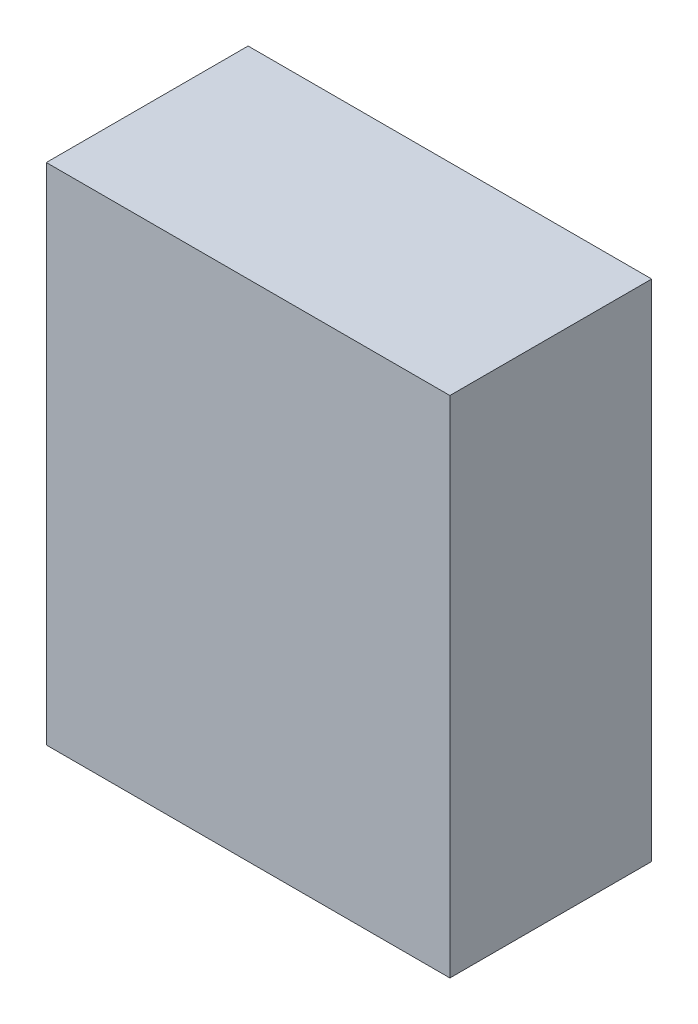
from build123d import *

# Parameters (mm, degrees)
BLOCKBASE_W = 101.6
BLOCKBASE_H = 127
BLOCK_DEPTH = 50.8


with BuildPart() as part:
    # BlockBase → Block (new body)
    with BuildSketch(Plane.XY):
        Rectangle(BLOCKBASE_W, BLOCKBASE_H)
    extrude(amount=BLOCK_DEPTH)


solid = part.part
